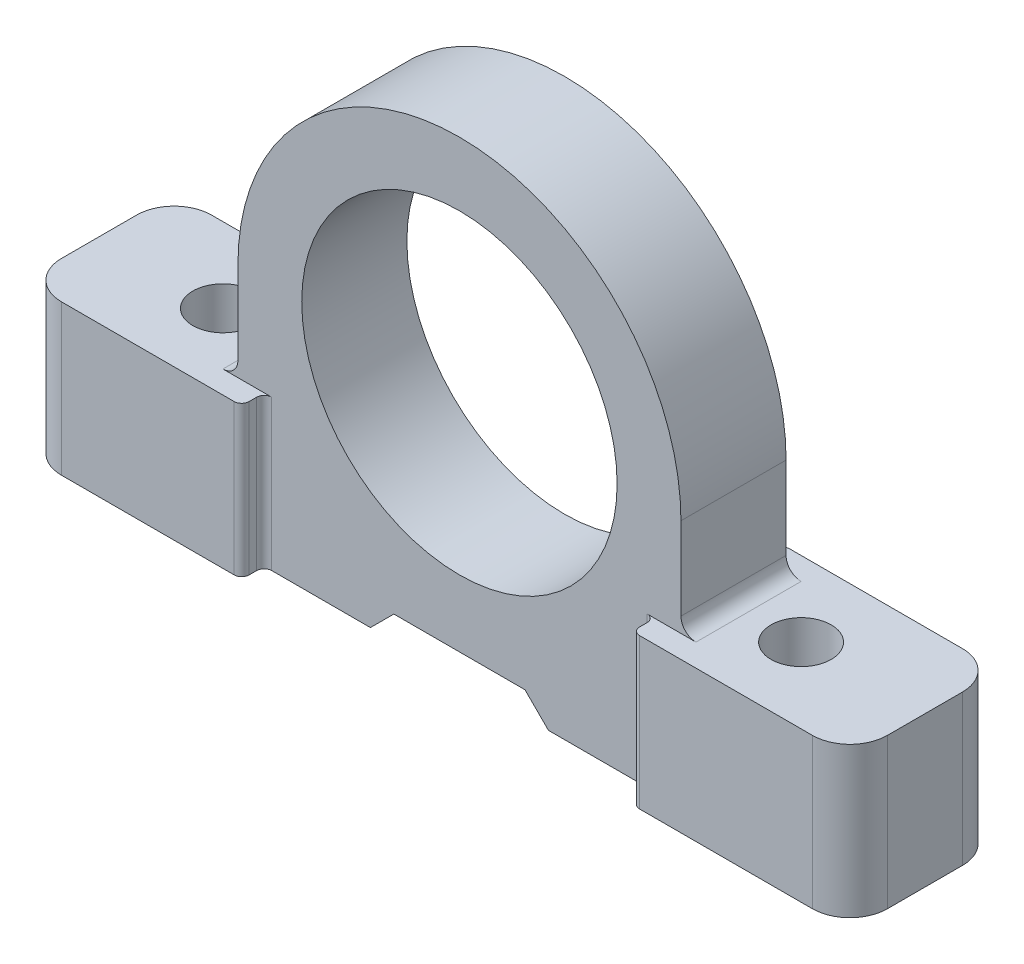
from build123d import *

# Parameters (mm, degrees)
SKETCH1_R           = 21
BOSS_EXTRUDE1_DEPTH = 7
SKETCH2_W           = 29
SKETCH2_H           = 20
BOSS_EXTRUDE2_DEPTH = 3
CUT_EXTRUDE1_DEPTH  = 67.355105305
FILLET1_R           = 5
FILLET2_R           = 1
SKETCH4_R           = 4
CUT_EXTRUDE2_DEPTH  = 71.222859526


with BuildPart() as part:
    # Sketch1 → Boss-Extrude1 (new, symmetric)
    with BuildSketch(Plane.XY):
        with BuildLine():
            Line((-29.5, 0), (-29.5, -11))
            ThreePointArc((-29.5, -11), (-30.085786438, -12.414213562), (-31.5, -13))
            Line((-31.5, -13), (-55, -13))
            Line((-55, -13), (-55, -33))
            Line((-55, -33), (55, -33))
            Line((55, -33), (55, -13))
            Line((55, -13), (31.5, -13))
            ThreePointArc((31.5, -13), (30.085786438, -12.414213562), (29.5, -11))
            Line((29.5, -11), (29.5, 0))
            ThreePointArc((29.5, 0), (0, 29.5), (-29.5, 0))
        make_face()
        Circle(SKETCH1_R, mode=Mode.SUBTRACT)
    extrude(amount=BOSS_EXTRUDE1_DEPTH, both=True)

    # Sketch2 → Boss-Extrude2 (add)
    with BuildSketch(Plane.XY.offset(7)):
        with Locations((-40.5, -23)):
            Rectangle(SKETCH2_W, SKETCH2_H)
        with Locations((40.5, -23)):
            Rectangle(SKETCH2_W, SKETCH2_H)
    boss_extrude2 = extrude(amount=BOSS_EXTRUDE2_DEPTH)

    # Mirror1: Boss-Extrude2 across plane
    add(boss_extrude2.mirror(Plane.XY))

    # Sketch3 → Cut-Extrude1 (cut, through all)
    with BuildSketch(Plane.XY.offset(7)):
        Polygon((-11.85382749, -33), (-8.732636014, -29.878808524), (8.732636014, -29.878808524), (11.85382749, -33), align=None)
    extrude(amount=-CUT_EXTRUDE1_DEPTH, mode=Mode.SUBTRACT)

    # Fillet1
    fillet1_edges = [part.edges().sort_by_distance(p)[0] for p in [
        (-55, -23, 10),
        (55, -23, 10),
        (-55, -23, -10),
        (55, -23, -10),
    ]]
    fillet(fillet1_edges, radius=FILLET1_R)

    # Fillet2
    fillet2_edges = [part.edges().sort_by_distance(p)[0] for p in [
        (-26, -23, 7),
        (-26, -23, 10),
        (26, -23, 7),
        (26, -23, 10),
        (-26, -23, -10),
        (-26, -23, -7),
        (26, -23, -10),
        (26, -23, -7),
    ]]
    fillet(fillet2_edges, radius=FILLET2_R)

    # Sketch4 → Cut-Extrude2 (cut, through all)
    with BuildSketch(Plane(origin=(0, -13, 0), x_dir=(1, 0, 0), z_dir=(0, 1, 0))):
        with Locations(Location((38.5, 0, 0), (0, 0, 180))):
            Circle(SKETCH4_R)
        with Locations((-38.5, 0)):
            Circle(SKETCH4_R)
    extrude(amount=-CUT_EXTRUDE2_DEPTH, mode=Mode.SUBTRACT)


solid = part.part
